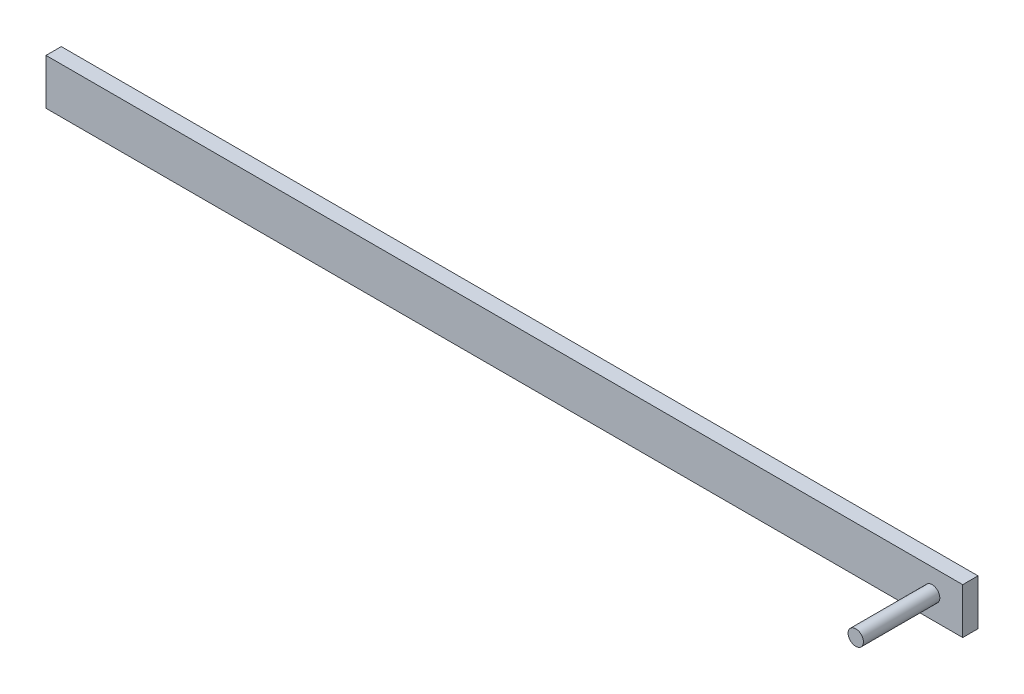
from build123d import *

# Parameters (mm, degrees)
SKETCH1_W           = 600
SKETCH1_H           = 30
BOSS_EXTRUDE1_DEPTH = 10
SKETCH2_R           = 5
BOSS_EXTRUDE2_DEPTH = 50


with BuildPart() as part:
    # Sketch1 → Boss-Extrude1 (new body)
    with BuildSketch(Plane.XY):
        Rectangle(SKETCH1_W, SKETCH1_H)
    extrude(amount=BOSS_EXTRUDE1_DEPTH)

    # Sketch2 → Boss-Extrude2 (add)
    with BuildSketch(Plane.XY.offset(10)):
        with Locations((280, 0)):
            Circle(SKETCH2_R)
    extrude(amount=BOSS_EXTRUDE2_DEPTH)


solid = part.part
